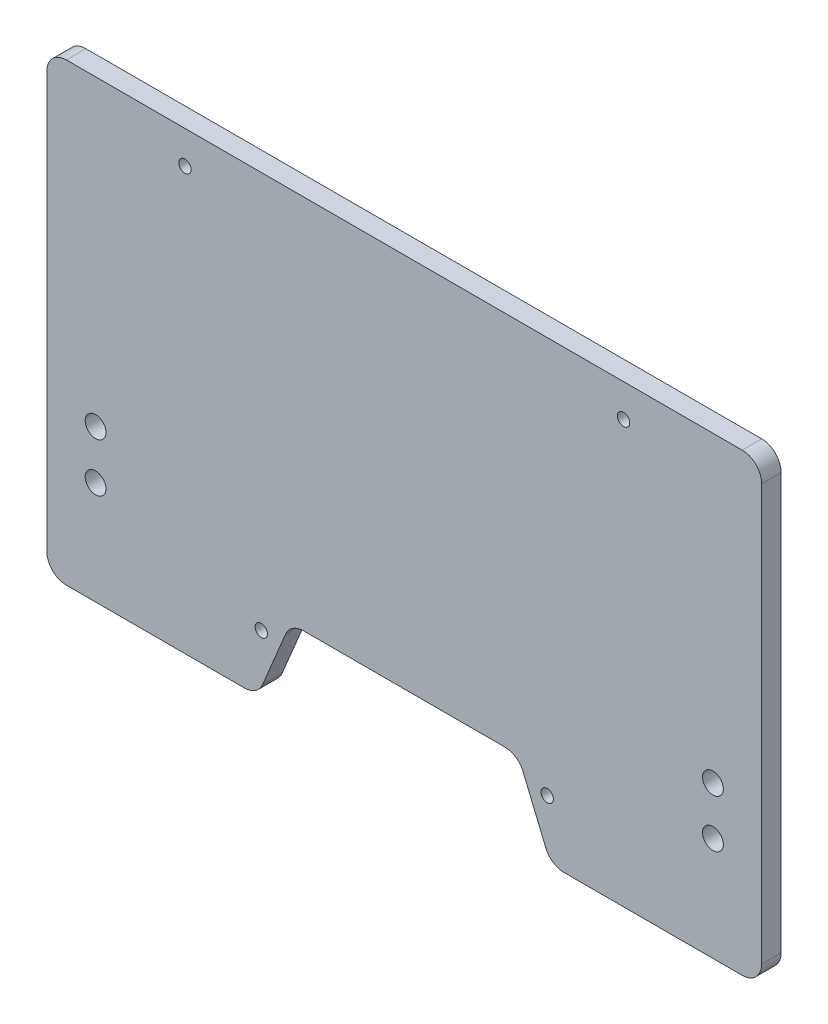
from build123d import *

# Parameters (mm, degrees)
SKETCH_1_R      = 1.6
SKETCH_1_R_2    = 0.95
EXTRUDE_1_DEPTH = 3


with BuildPart() as part:
    # 草图1 → 凸台-拉伸1 (new body)
    with BuildSketch(Plane.XY):
        with BuildLine():
            Line((32, 23.279914581), (63, 23.279914581))
            ThreePointArc((63, 23.279914581), (64.664100589, 22.776065464), (65.769230769, 21.433760735))
            Line((65.769230769, 21.433760735), (66.730769231, 19.126068427))
            Line((66.730769231, 19.126068427), (69.29930559, 12.961581165))
            ThreePointArc((69.29930559, 12.961581165), (70.404435771, 11.619276436), (72.068536359, 11.115427319))
            Line((72.068536359, 11.115427319), (99.5, 11.115427319))
            ThreePointArc((99.5, 11.115427319), (101.621320344, 11.994106975), (102.5, 14.115427319))
            Line((102.5, 14.115427319), (102.5, 78.115427319))
            ThreePointArc((102.5, 78.115427319), (101.621320344, 80.236747662), (99.5, 81.115427319))
            Line((99.5, 81.115427319), (-4.5, 81.115427319))
            ThreePointArc((-4.5, 81.115427319), (-6.621320344, 80.236747662), (-7.5, 78.115427319))
            Line((-7.5, 78.115427319), (-7.5, 14.115427319))
            ThreePointArc((-7.5, 14.115427319), (-6.621320344, 11.994106975), (-4.5, 11.115427319))
            Line((-4.5, 11.115427319), (22.931463641, 11.115427319))
            ThreePointArc((22.931463641, 11.115427319), (24.595564229, 11.619276436), (25.70069441, 12.961581165))
            Line((25.70069441, 12.961581165), (28.269230769, 19.126068427))
            Line((28.269230769, 19.126068427), (29.230769231, 21.433760735))
            ThreePointArc((29.230769231, 21.433760735), (30.335899411, 22.776065464), (32, 23.279914581))
        make_face()
        with Locations((0, 34.5)):
            Circle(SKETCH_1_R, mode=Mode.SUBTRACT)
        with Locations((0, 27)):
            Circle(SKETCH_1_R, mode=Mode.SUBTRACT)
        with Locations((95, 34.5)):
            Circle(SKETCH_1_R, mode=Mode.SUBTRACT)
        with Locations((95, 27.1)):
            Circle(SKETCH_1_R, mode=Mode.SUBTRACT)
        with Locations((13.75, 76.079914581)):
            Circle(SKETCH_1_R_2, mode=Mode.SUBTRACT)
        with Locations((81.25, 76.079914581)):
            Circle(SKETCH_1_R_2, mode=Mode.SUBTRACT)
        with Locations((69.5, 20.079914581)):
            Circle(SKETCH_1_R_2, mode=Mode.SUBTRACT)
        with Locations((25.5, 20.079914581)):
            Circle(SKETCH_1_R_2, mode=Mode.SUBTRACT)
    extrude(amount=EXTRUDE_1_DEPTH)


solid = part.part
